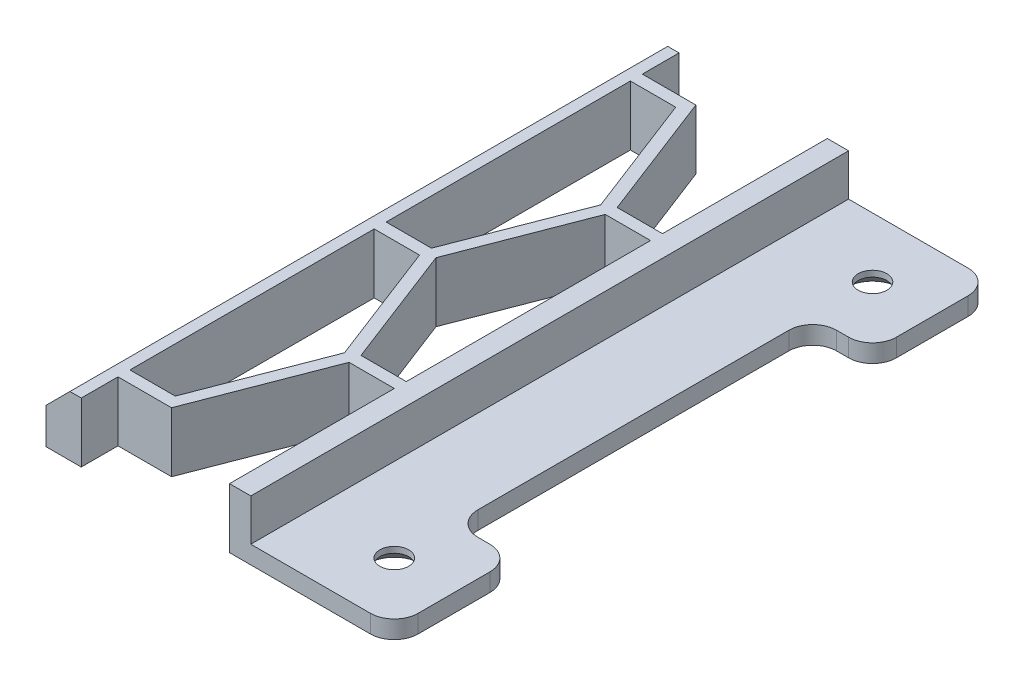
from build123d import *

# Parameters (mm, degrees)
BOSS_EXTRUDE1_DEPTH                            = 5
BOSS_EXTRUDE3_DEPTH                            = 1.5
FILLET1_R                                      = 2
CSK_FOR_M2_FLAT_HEAD_MACHINE_SCREW1_AT_2_COUNT = 2
CSK_FOR_M2_FLAT_HEAD_MACHINE_SCREW1_AT_2_PITCH = 40
CHAMFER1_SIZE                                  = 2


with BuildPart() as part:
    # Sketch1 → Boss-Extrude1 (new body)
    with BuildSketch(Plane(origin=(0, 0, 0), x_dir=(1, 0, 0), z_dir=(0, 1, 0))):
        Polygon((-14.18, 46.928571429), (-14.18, 50), (-17.13, 50), (-17.13, 0), (-14.18, 0), (-14.18, 3.071428571), (-9.703639402, 3.071428571), (-5.570306069, 13.785714286), (-1.78, 13.785714286), (-1.78, 0), (0, 0), (0, 50), (-1.78, 50), (-1.78, 36.214285714), (-5.570306069, 36.214285714), (-9.703639402, 46.928571429), align=None)
        Polygon((-14.18, 4.071428571), (-14.18, 24.5), (-10.389693931, 24.5), (-6.449249487, 14.285714286), (-10.389693931, 4.071428571), align=None, mode=Mode.SUBTRACT)
        Polygon((-10.389693931, 45.928571429), (-6.449249487, 35.714285714), (-10.389693931, 25.5), (-14.18, 25.5), (-14.18, 45.928571429), align=None, mode=Mode.SUBTRACT)
        Polygon((-5.570306069, 14.785714286), (-9.510750513, 25), (-5.570306069, 35.214285714), (-1.78, 35.214285714), (-1.78, 14.785714286), align=None, mode=Mode.SUBTRACT)
    extrude(amount=BOSS_EXTRUDE1_DEPTH)

    # Sketch5 → Boss-Extrude3 (add)
    with BuildSketch(Plane.XZ):
        Polygon((12, -40), (12, -50), (0, -50), (0, 0), (12, 0), (12, -10), (7, -10), (7, -40), align=None)
    extrude(amount=-BOSS_EXTRUDE3_DEPTH)

    # Fillet1
    fillet1_edges = [part.edges().sort_by_distance(p)[0] for p in [
        (12, 0.75, -40),
        (12, 0.75, -50),
        (12, 0.75, 0),
        (12, 0.75, -10),
        (7, 0.75, -10),
        (7, 0.75, -40),
    ]]
    fillet(fillet1_edges, radius=FILLET1_R)

    # Sketch6 → CSK for M2 Flat Head Machine Screw1 (revolve, cut)
    with BuildSketch(Plane(origin=(7, 0, -5), x_dir=(0, 0, -1), z_dir=(1, 0, 0))):
        Polygon((0, 0), (0, 1.5), (1.2, 1.5), (1.2, 1), (2.2, 0), align=None)
    csk_for_m2_flat_head_machine_screw1 = revolve(axis=Axis((7, -6.35, -5), (0, 1, 0)), mode=Mode.SUBTRACT)

    # CSK for M2 Flat Head Machine Screw1 at 2: CSK for M2 Flat Head Machine Screw1 ×2
    with Locations(*[(0, 0, -i * CSK_FOR_M2_FLAT_HEAD_MACHINE_SCREW1_AT_2_PITCH) for i in range(1, CSK_FOR_M2_FLAT_HEAD_MACHINE_SCREW1_AT_2_COUNT)]):
        add(csk_for_m2_flat_head_machine_screw1, mode=Mode.SUBTRACT)

    # Chamfer1
    chamfer1_edges = [part.edges().sort_by_distance(p)[0] for p in [
        (-17.13, 5, -25),
    ]]
    chamfer(chamfer1_edges, length=CHAMFER1_SIZE)


solid = part.part
